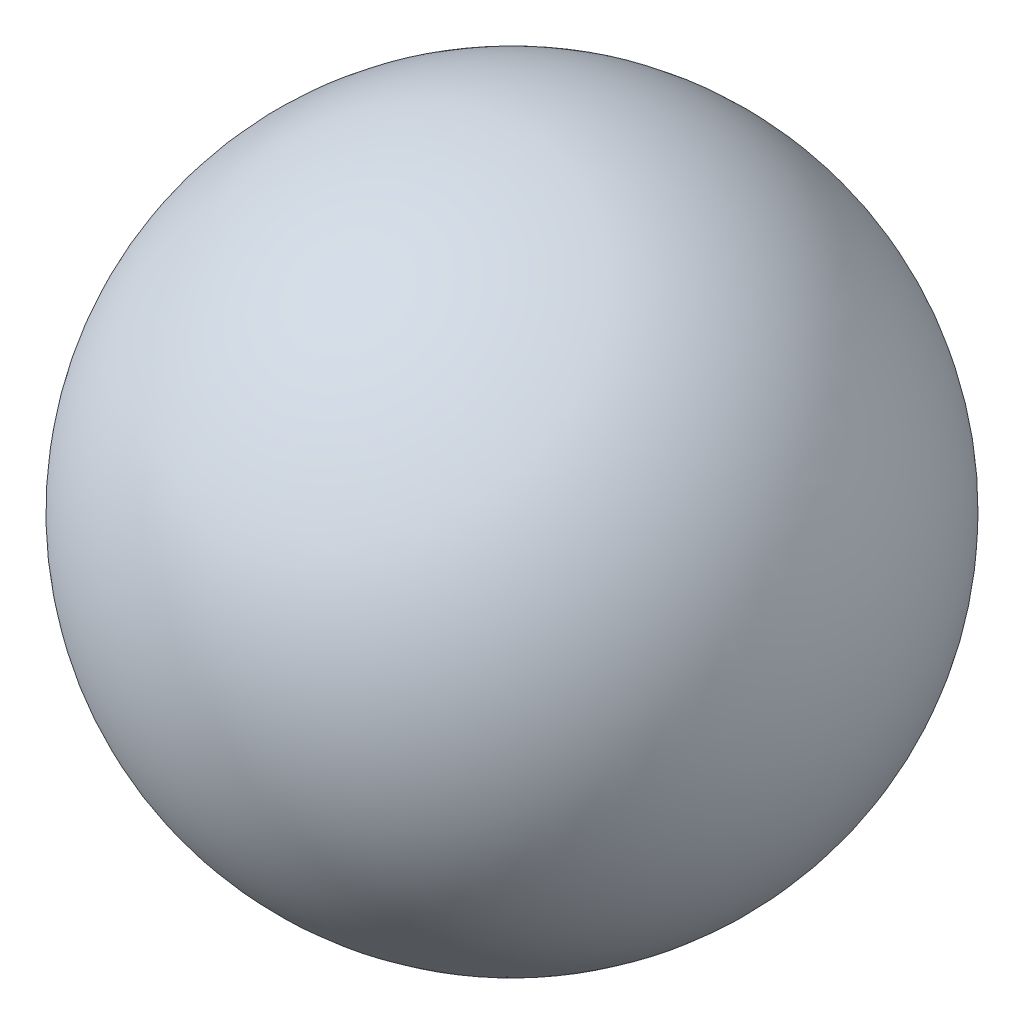
from build123d import *

# Parameters (mm, degrees)
SKETCH_3_R          = 2.5
CUT_EXTRUDE_1_DEPTH = 5


with BuildPart() as part:
    # 草图1 → 旋转1 (revolve)
    with BuildSketch(Plane.XY):
        with BuildLine():
            Line((0, 7), (0, -6.45))
            Line((0, -6.45), (2.719834554, -6.45))
            ThreePointArc((2.719834554, -6.45), (6.861122357, 1.387443693), (0, 7))
        make_face()
    revolve(axis=Axis((0, 11.860418453, 0), (0, -1, 0)))

    # 草图3 → 切除-拉伸1 (cut)
    with BuildSketch(Plane.XZ.offset(6.45)):
        Circle(SKETCH_3_R)
    extrude(amount=-CUT_EXTRUDE_1_DEPTH, mode=Mode.SUBTRACT)


solid = part.part
